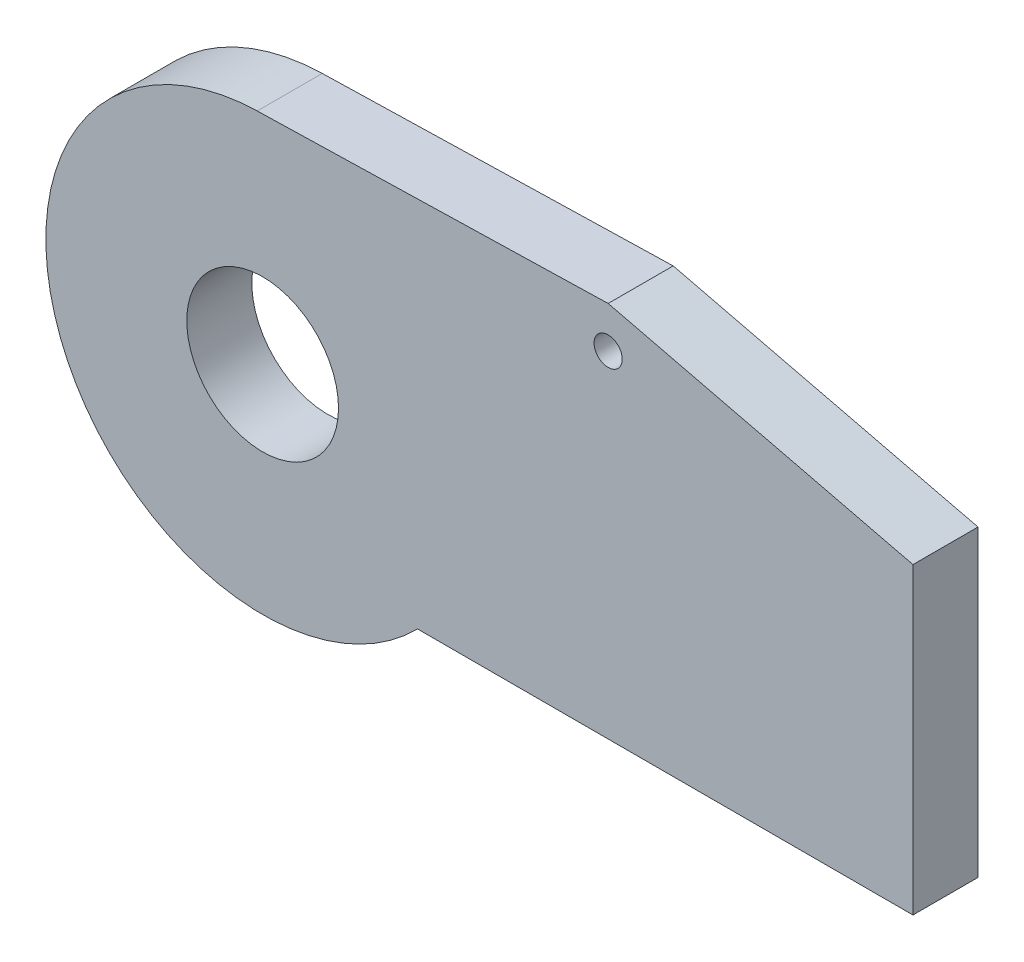
from build123d import *

# Parameters (mm, degrees)
SKETCH1_R           = 17.5
SKETCH1_R_2         = 3.25
BOSS_EXTRUDE1_DEPTH = 15


with BuildPart() as part:
    # Sketch1 → Boss-Extrude1 (new body)
    with BuildSketch(Plane.XY):
        with BuildLine():
            Line((149.99990581, 70.000115429), (79.694106831, 87.00526078))
            Line((79.694106831, 87.00526078), (-1.24795586, 84.984541416))
            ThreePointArc((-1.24795586, 84.984541416), (-45.852560512, 15.061426098), (35.707047952, 0.000115429))
            Line((35.707047952, 0.000115429), (149.99990581, 0.000115429))
            Line((149.99990581, 0.000115429), (149.99990581, 70.000115429))
        make_face()
        with Locations((-9.419e-05, 35.000115429)):
            Circle(SKETCH1_R, mode=Mode.SUBTRACT)
        with Locations((79.694106831, 77.479356086)):
            Circle(SKETCH1_R_2, mode=Mode.SUBTRACT)
    extrude(amount=BOSS_EXTRUDE1_DEPTH)


solid = part.part
